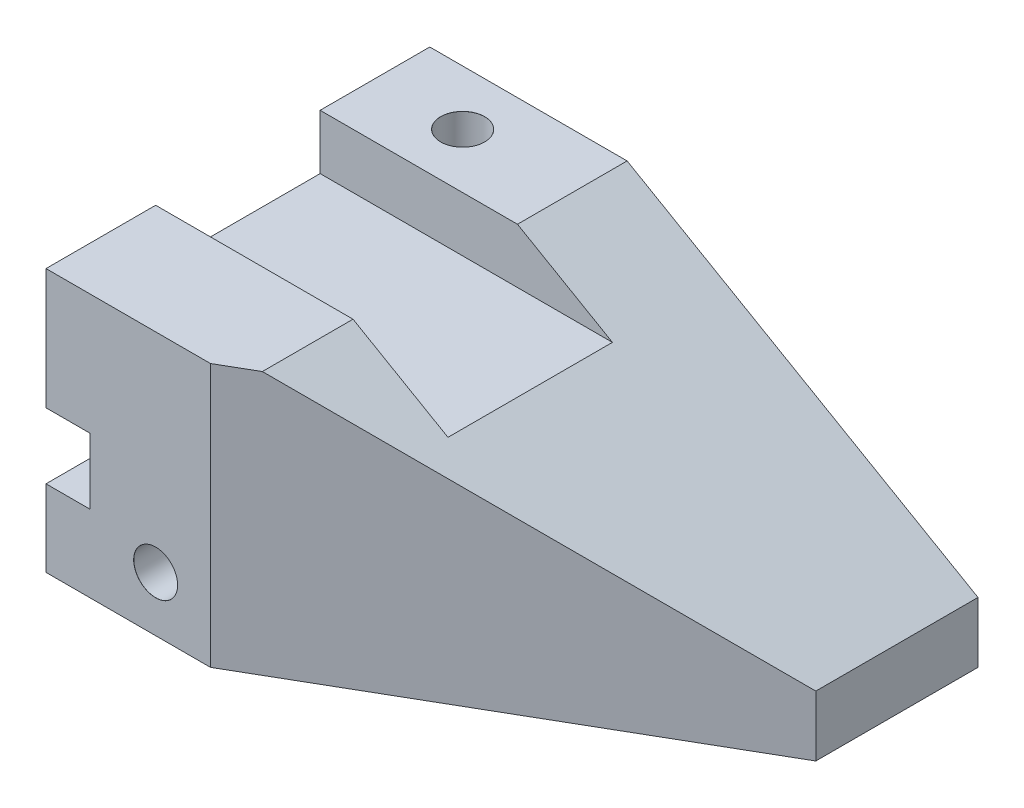
from build123d import *

# Parameters (mm, degrees)
SKETCH1_W                        = 250
SKETCH1_H                        = 175
BOSS_EXTRUDE1_DEPTH              = 120
SKETCH3_W                        = 250
SKETCH3_H                        = 75
CUT_EXTRUDE1_DEPTH               = 25
CUT_EXTRUDE2_REACH               = 329.91
SKETCH4_W                        = 20
SKETCH4_H                        = 30
F_20_0MM_DOWEL_HOLE1_D           = 20
F_20_0MM_DOWEL_HOLE1_CSINK_D     = 20.05
F_20_0MM_DOWEL_HOLE1_CSINK_ANGLE = 90
F_20_0MM_DOWEL_HOLE2_D           = 20
F_20_0MM_DOWEL_HOLE2_CSINK_D     = 20.05
F_20_0MM_DOWEL_HOLE2_CSINK_ANGLE = 90
CUT_EXTRUDE3_REACH               = 329.91
CUT_EXTRUDE4_REACH               = 329.91


with BuildPart() as part:
    # Sketch1 → Boss-Extrude1 (new body)
    with BuildSketch(Plane(origin=(0, 0, 0), x_dir=(1, 0, 0), z_dir=(0, 1, 0))):
        with Locations((125, 87.5)):
            Rectangle(SKETCH1_W, SKETCH1_H)
    extrude(amount=BOSS_EXTRUDE1_DEPTH)

    # Sketch3 → Cut-Extrude1 (cut)
    with BuildSketch(Plane(origin=(0, 120, 0), x_dir=(1, 0, 0), z_dir=(0, 1, 0))):
        with Locations((125, 87.5)):
            Rectangle(SKETCH3_W, SKETCH3_H)
    extrude(amount=-CUT_EXTRUDE1_DEPTH, mode=Mode.SUBTRACT)

    # Sketch4 → Cut-Extrude2 (cut, up to next)
    with BuildSketch(Plane.XY, mode=Mode.PRIVATE) as cut_extrude2_sk1:
        with Locations((10, 50)):
            Rectangle(SKETCH4_W, SKETCH4_H)
    cut_extrude2_tool1 = extrude(cut_extrude2_sk1.sketch, amount=-CUT_EXTRUDE2_REACH, mode=Mode.PRIVATE) & part.part
    add(cut_extrude2_tool1.solids().sort_by_distance((10, 50, 0))[0], mode=Mode.SUBTRACT)

    # Ø20.0mm Dowel Hole1 (through all)
    with Locations(Plane.XY):
        with Locations((50, 25)):
            CounterSinkHole(F_20_0MM_DOWEL_HOLE1_D / 2, F_20_0MM_DOWEL_HOLE1_CSINK_D / 2, counter_sink_angle=F_20_0MM_DOWEL_HOLE1_CSINK_ANGLE)

    # Ø20.0mm Dowel Hole2 (through all)
    with Locations(Plane(origin=(0, 120, 0), x_dir=(1, 0, 0), z_dir=(0, 1, 0))):
        with Locations((40, 150)):
            CounterSinkHole(F_20_0MM_DOWEL_HOLE2_D / 2, F_20_0MM_DOWEL_HOLE2_CSINK_D / 2, counter_sink_angle=F_20_0MM_DOWEL_HOLE2_CSINK_ANGLE)

    # Sketch11 → Cut-Extrude3 (cut, up to next)
    with BuildSketch(Plane.XY, mode=Mode.PRIVATE) as cut_extrude3_sk1:
        Polygon((90, 120), (250, 27.62395693), (250, 120), align=None)
    cut_extrude3_tool1 = extrude(cut_extrude3_sk1.sketch, amount=-CUT_EXTRUDE3_REACH, mode=Mode.PRIVATE) & part.part
    add(cut_extrude3_tool1.solids().sort_by_distance((196.666667, 89.207986, 0))[0], mode=Mode.SUBTRACT)

    # Sketch12 → Cut-Extrude4 (cut, up to next)
    with BuildSketch(Plane(origin=(0, 120, 0), x_dir=(1, 0, 0), z_dir=(0, 1, 0)), mode=Mode.PRIVATE) as cut_extrude4_sk1:
        Polygon((75, 0), (250, 101.036297108), (250, 0), align=None)
    cut_extrude4_tool1 = extrude(cut_extrude4_sk1.sketch, amount=-CUT_EXTRUDE4_REACH, mode=Mode.PRIVATE) & part.part
    add(cut_extrude4_tool1.solids().sort_by_distance((191.666667, 120, -33.678766))[0], mode=Mode.SUBTRACT)


solid = part.part
